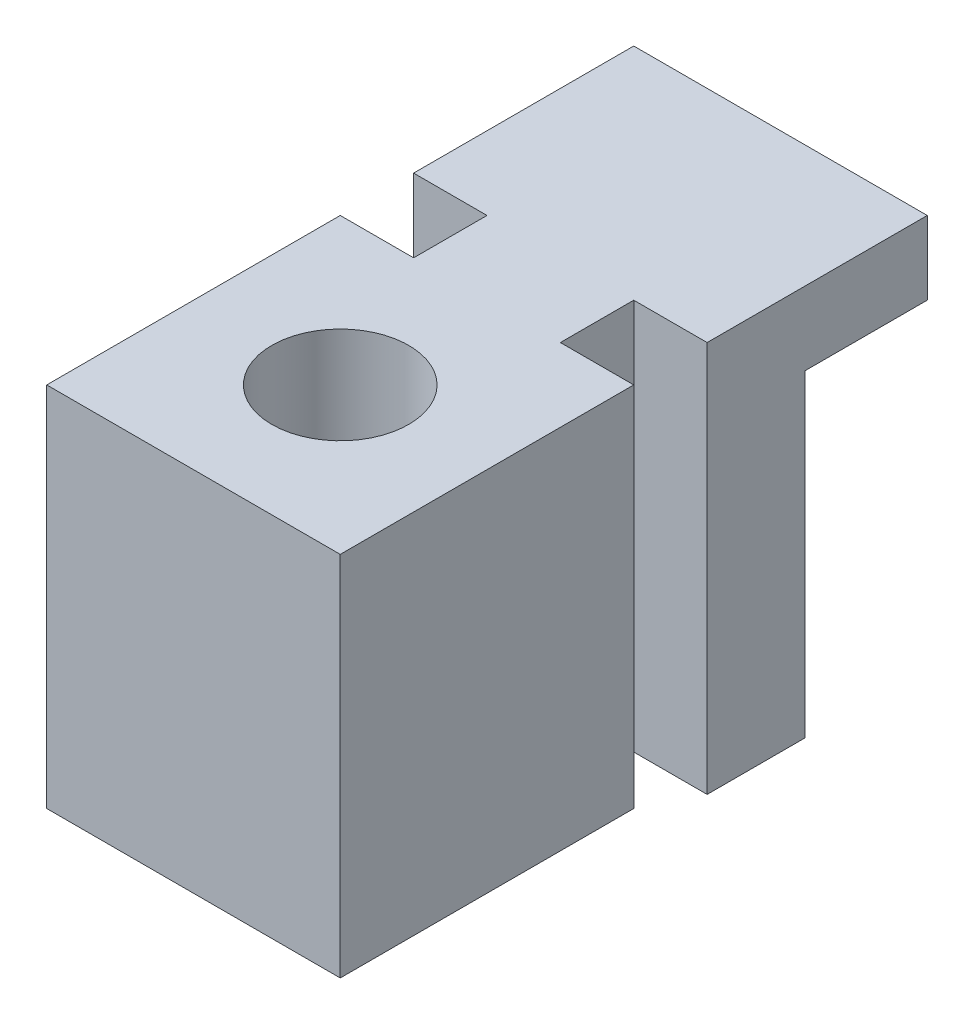
from build123d import *

# Parameters (mm, degrees)
SKETCH3_W           = 6
SKETCH3_H           = 6.5
BOSS_EXTRUDE3_DEPTH = 2
SKETCH4_W           = 3
SKETCH4_H           = 1.5
BOSS_EXTRUDE4_DEPTH = 6
SKETCH5_W           = 6
SKETCH5_H           = 6
SKETCH5_R           = 1.4
BOSS_EXTRUDE5_DEPTH = 6
BOSS_EXTRUDE6_START = 1.5
SKETCH9_R           = 1.4
BOSS_EXTRUDE6_DEPTH = 1.5
SKETCH10_W          = 6
SKETCH10_H          = 1.5
BOSS_EXTRUDE7_DEPTH = 2.5


with BuildPart() as part:
    # Sketch3 → Boss-Extrude3 (new body)
    with BuildSketch(Plane.XY):
        Rectangle(SKETCH3_W, SKETCH3_H)
    extrude(amount=BOSS_EXTRUDE3_DEPTH)

    # Sketch4 → Boss-Extrude4 (add)
    with BuildSketch(Plane(origin=(0, 3.25, 0), x_dir=(1, 0, 0), z_dir=(0, 1, 0))):
        with Locations((0, -2.75)):
            Rectangle(SKETCH4_W, SKETCH4_H)
    extrude(amount=-BOSS_EXTRUDE4_DEPTH)

    # Sketch5 → Boss-Extrude5 (add)
    with BuildSketch(Plane(origin=(0, 3.25, 0), x_dir=(1, 0, 0), z_dir=(0, 1, 0))):
        with Locations((0, -6.5)):
            Rectangle(SKETCH5_W, SKETCH5_H)
        with Locations(Location((0, -6.5, 0), (0, 0, 270))):
            Circle(SKETCH5_R, mode=Mode.SUBTRACT)
    extrude(amount=-BOSS_EXTRUDE5_DEPTH)

    # Sketch9 → Boss-Extrude6 (add)
    with BuildSketch(Plane(origin=(0, 3.25, 0), x_dir=(1, 0, 0), z_dir=(0, 1, 0)).offset(BOSS_EXTRUDE6_START)):
        Polygon((3, -9.5), (-3, -9.5), (-3, -3.5), (-1.5, -3.5), (-1.5, -2), (-3, -2), (-3, 0), (3, 0), (3, -2), (1.5, -2), (1.5, -3.5), (3, -3.5), align=None)
        with Locations(Location((0, -6.5, 0), (0, 0, 270))):
            Circle(SKETCH9_R, mode=Mode.SUBTRACT)
    extrude(amount=-BOSS_EXTRUDE6_DEPTH)

    # Sketch10 → Boss-Extrude7 (add)
    with BuildSketch(Plane(origin=(0, 0, 0), x_dir=(-1, 0, 0), z_dir=(0, 0, -1))):
        with Locations((0, 4)):
            Rectangle(SKETCH10_W, SKETCH10_H)
    extrude(amount=BOSS_EXTRUDE7_DEPTH)


solid = part.part
